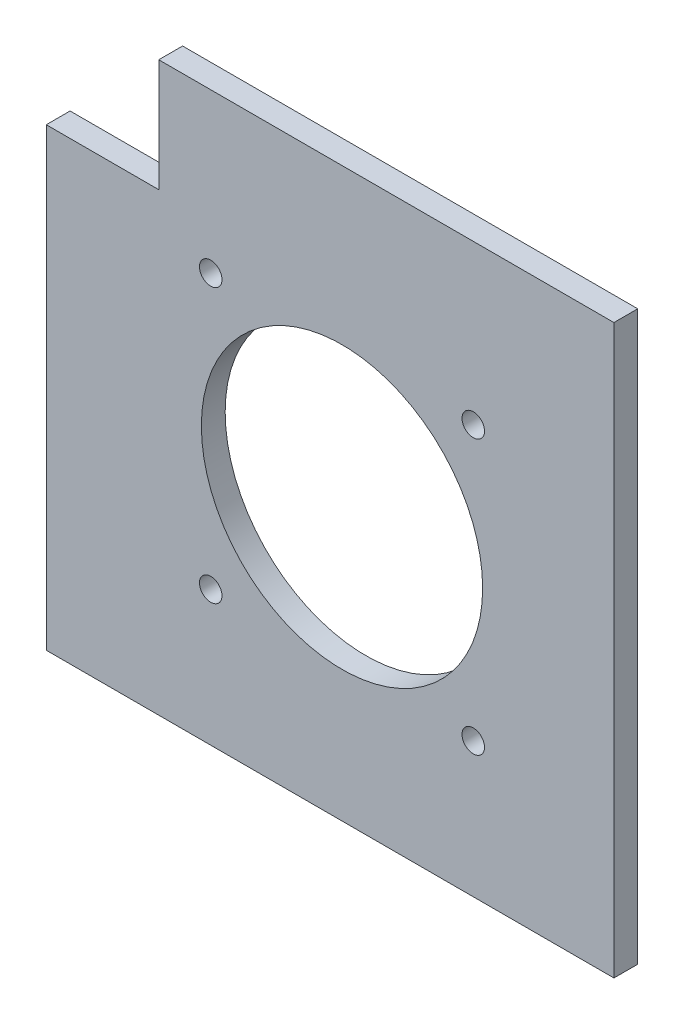
from build123d import *

# Parameters (mm, degrees)
SALIENTE_EXTRUIR1_DEPTH = 6.35
CROQUIS2_R              = 37.5
CROQUIS2_R_2            = 3
CORTAR_EXTRUIR1_DEPTH   = 6.35


with BuildPart() as part:
    # Croquis1 → Saliente-Extruir1 (new body)
    with BuildSketch(Plane.XY):
        Polygon((-50.356515977, -4.516705607), (-50.356515977, -125.866705607), (100.993484023, -125.866705607), (100.993484023, 25.483294393), (-20.356515977, 25.483294393), (-20.356515977, -4.516705607), align=None)
    extrude(amount=SALIENTE_EXTRUIR1_DEPTH)

    # Croquis2 → Cortar-Extruir1 (cut)
    with BuildSketch(Plane.XY.offset(6.35)):
        with Locations((28.493484023, -53.366705607)):
            Circle(CROQUIS2_R)
        with Locations((-6.506515977, -16.866705607)):
            Circle(CROQUIS2_R_2)
        with Locations((-6.506515977, -89.866705607)):
            Circle(CROQUIS2_R_2)
        with Locations(Location((63.493484023, -16.866705607, 0), (0, 0, 180))):
            Circle(CROQUIS2_R_2)
        with Locations(Location((63.493484023, -89.866705607, 0), (0, 0, 180))):
            Circle(CROQUIS2_R_2)
    extrude(amount=-CORTAR_EXTRUIR1_DEPTH, mode=Mode.SUBTRACT)


solid = part.part
